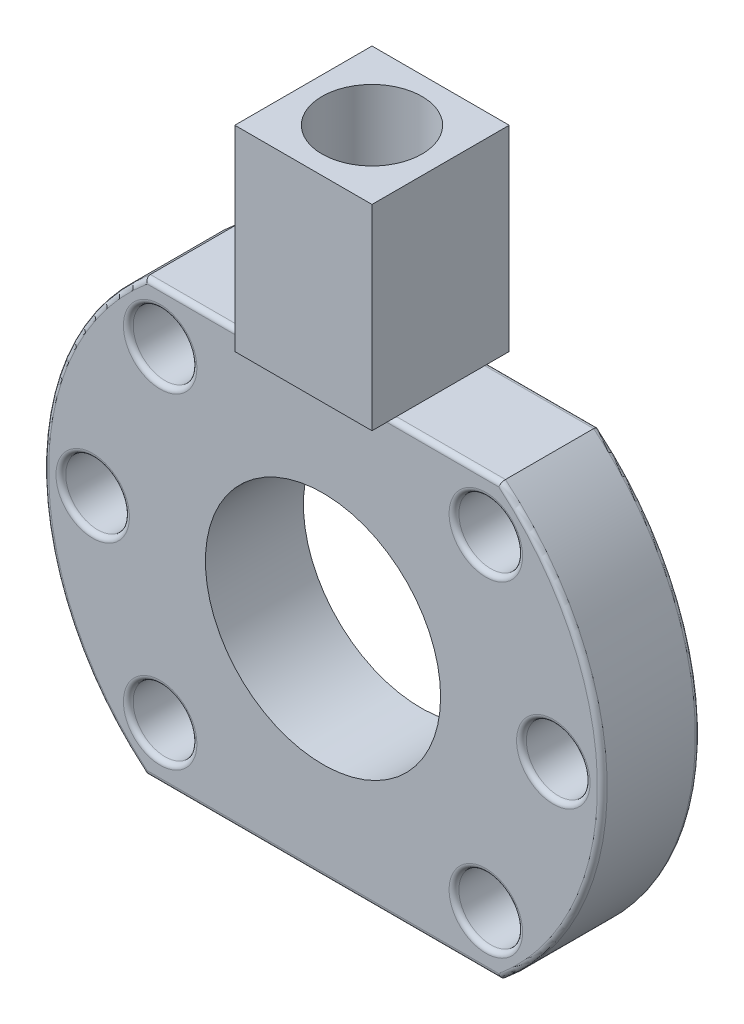
from build123d import *

# Parameters (mm, degrees)
BOSS_EXTRU_1_DEPTH      = 10
CONG_1_R                = 0.5
ESQUISSE2_R             = 12
ESQUISSE2_R_2           = 3.25
ENL_V_MAT_EXTRU_1_DEPTH = 10
CONG_2_R                = 0.5
ESQUISSE3_W             = 14
ESQUISSE3_H             = 14
BOSS_EXTRU_3_DEPTH      = 20
M12_TAPPED_HOLE1_D      = 10.2
M12_TAPPED_HOLE1_DEPTH  = 18
M12_TAPPED_HOLE1_TIP    = 3.064389157


with BuildPart() as part:
    # Esquisse1 → Boss.-Extru.1 (new body)
    with BuildSketch(Plane.XY):
        with BuildLine():
            Line((-18.117670932, 22), (18.117670932, 22))
            ThreePointArc((18.117670932, 22), (28.5, 0), (18.117670932, -22))
            Line((18.117670932, -22), (-18.117670932, -22))
            ThreePointArc((-18.117670932, -22), (-28.5, 0), (-18.117670932, 22))
        make_face()
    extrude(amount=BOSS_EXTRU_1_DEPTH)

    # Congé1
    cong_1_edges = [part.edges().sort_by_distance(p)[0] for p in [
        (0, -22, 0),
        (-28.5, 0, 0),
        (0, 22, 0),
        (28.5, 0, 0),
        (28.5, 0, 10),
        (0, -22, 10),
        (-28.5, 0, 10),
        (0, 22, 10),
    ]]
    fillet(cong_1_edges, radius=CONG_1_R)

    # Esquisse2 → Enlèv. mat.-Extru.1 (cut)
    with BuildSketch(Plane.XY.offset(10)):
        Circle(ESQUISSE2_R)
        with Locations((-23.5, 0)):
            Circle(ESQUISSE2_R_2)
        with Locations((23.5, 0)):
            Circle(ESQUISSE2_R_2)
        with Locations((-16.617009358, 16.617009358)):
            Circle(ESQUISSE2_R_2)
        with Locations((16.617009358, -16.617009358)):
            Circle(ESQUISSE2_R_2)
        with Locations((16.617009358, 16.617009358)):
            Circle(ESQUISSE2_R_2)
        with Locations((-16.617009358, -16.617009358)):
            Circle(ESQUISSE2_R_2)
    extrude(amount=-ENL_V_MAT_EXTRU_1_DEPTH, mode=Mode.SUBTRACT)

    # Congé2
    cong_2_edges = [part.edges().sort_by_distance(p)[0] for p in [
        (13.367009358, 16.617009358, 10),
        (20.25, 0, 10),
        (13.367009358, -16.617009358, 10),
        (-19.867009358, -16.617009358, 10),
        (-26.75, 0, 10),
        (-19.867009358, 16.617009358, 10),
    ]]
    fillet(cong_2_edges, radius=CONG_2_R)

    # Esquisse3 → Boss.-Extru.3 (add)
    with BuildSketch(Plane(origin=(0, 22, 0), x_dir=(1, 0, 0), z_dir=(0, 1, 0))):
        with Locations((0, -5)):
            Rectangle(ESQUISSE3_W, ESQUISSE3_H)
    extrude(amount=BOSS_EXTRU_3_DEPTH)

    # M12 Tapped Hole1
    with Locations(Plane(origin=(0, 42, 0), x_dir=(1, 0, 0), z_dir=(0, 1, 0))):
        with Locations((0, -5)):
            Hole(M12_TAPPED_HOLE1_D / 2, depth=M12_TAPPED_HOLE1_DEPTH)
            with Locations((0, 0, -(M12_TAPPED_HOLE1_DEPTH + M12_TAPPED_HOLE1_TIP / 2))):  # 118° drill point
                Cone(0, M12_TAPPED_HOLE1_D / 2, M12_TAPPED_HOLE1_TIP, mode=Mode.SUBTRACT)


solid = part.part
